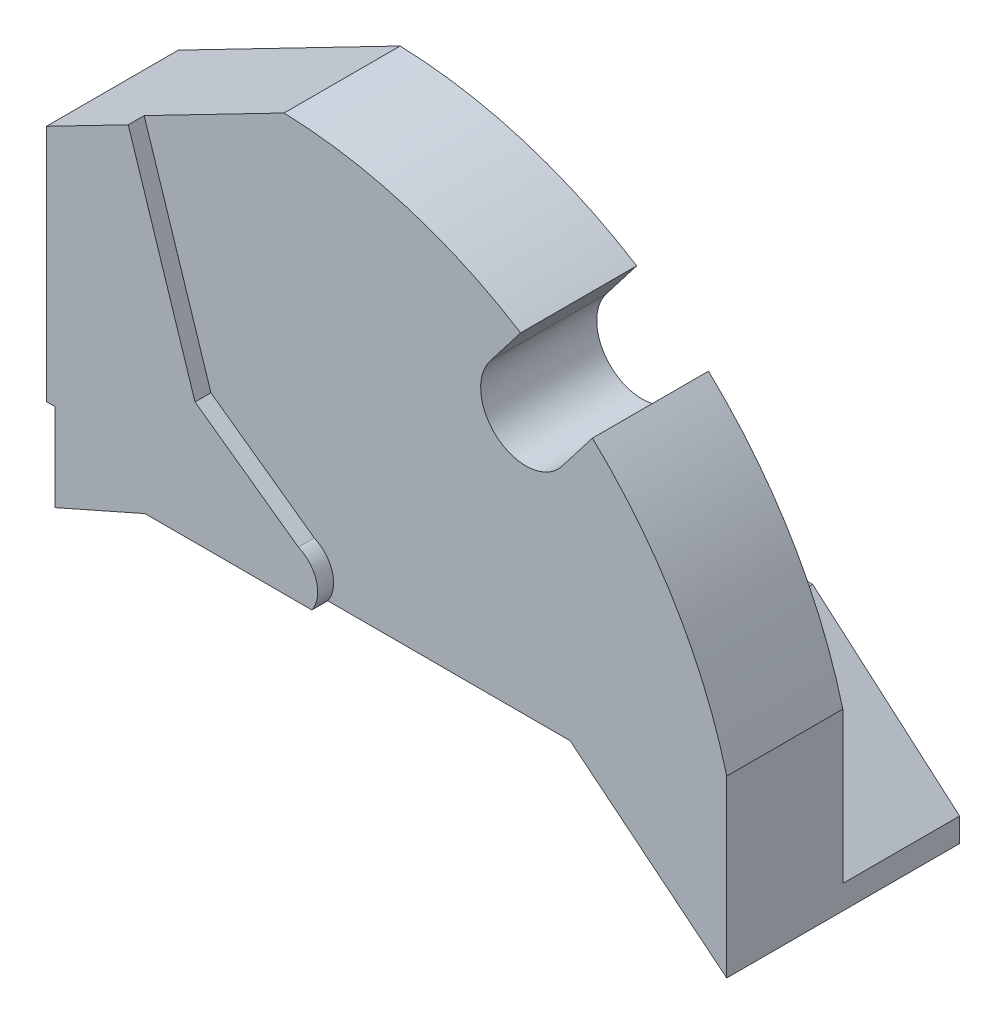
from build123d import *

# Parameters (mm, degrees)
ESTRUSIONE_ESTRUSIONE1_DEPTH  = 14.6
SCHIZZO2_W                    = 64
SCHIZZO2_H                    = 3
ESTRUSIONE_ESTRUSIONE2_DEPTH  = 14.7
ESTRUSIONE_ESTRUSIONE3_DEPTH  = 11.3
ESTRUSIONE_ESTRUSIONE4_DEPTH  = 14.9
SCHIZZO6_W                    = 64
SCHIZZO6_H                    = 3.1
ESTRUSIONE_ESTRUSIONE5_DEPTH  = 13
ESTRUSIONE_ESTRUSIONE8_START  = -64
ESTRUSIONE_ESTRUSIONE8_DEPTH  = 64
ESTRUSIONE_ESTRUSIONE9_DEPTH  = 14.6
ESTRUSIONE_ESTRUSIONE13_DEPTH = 14.7
ESTRUSIONE_ESTRUSIONE14_START = -3.1
ESTRUSIONE_ESTRUSIONE14_DEPTH = 3.1
TAGLIO_ESTRUSIONE3_DEPTH      = 15
TAGLIO_ESTRUSIONE4_REACH      = 94.756
ESTRUSIONE_ESTRUSIONE15_DEPTH = 2


with BuildPart() as part:
    # Schizzo1 → Estrusione-Estrusione1 (new body)
    with BuildSketch(Plane.XY):
        with BuildLine():
            Line((0, 30), (0, 0))
            Line((0, 0), (1.1, 0))
            Line((1.1, 0), (1.1, -6))
            Line((1.1, -6), (83.6, -6))
            Line((83.6, -6), (83.6, 0))
            ThreePointArc((83.6, 0), (77.157447993, 15.380640119), (66.7, 28.36957188))
            Line((66.7, 28.36957188), (62.855201518, 23.378827984))
            ThreePointArc((62.855201518, 23.378827984), (54.861139367, 22.342020228), (53.824331611, 30.336082379))
            Line((53.824331611, 30.336082379), (57.669130093, 35.326826275))
            ThreePointArc((57.669130093, 35.326826275), (43.389650216, 41.844502061), (27.902688632, 44.401387681))
            Line((27.902688632, 44.401387681), (0, 30))
        make_face()
    extrude(amount=ESTRUSIONE_ESTRUSIONE1_DEPTH)

    # Schizzo2 → Estrusione-Estrusione2 (add)
    with BuildSketch(Plane(origin=(0, 0, 0), x_dir=(-1, 0, 0), z_dir=(0, 0, -1))):
        with Locations((-33.1, -4.5)):
            Rectangle(SCHIZZO2_W, SCHIZZO2_H)
    extrude(amount=ESTRUSIONE_ESTRUSIONE2_DEPTH)

    # Schizzo4 → Estrusione-Estrusione3 (add)
    with BuildSketch(Plane.XY.offset(14.6)):
        Polygon((1.1, -6), (12.4, -6), (1.1, -11), align=None)
    extrude(amount=-ESTRUSIONE_ESTRUSIONE3_DEPTH)

    # Schizzo5 → Estrusione-Estrusione4 (add)
    with BuildSketch(Plane(origin=(0, 0, 3.3), x_dir=(-1, 0, 0), z_dir=(0, 0, -1))):
        Polygon((-1.1, -6), (-33.8, -6), (-1.1, -19), align=None)
    extrude(amount=ESTRUSIONE_ESTRUSIONE4_DEPTH)

    # Schizzo6 → Estrusione-Estrusione5 (add)
    with BuildSketch(Plane.XZ.offset(6)):
        with Locations((33.1, -13.15)):
            Rectangle(SCHIZZO6_W, SCHIZZO6_H)
    extrude(amount=ESTRUSIONE_ESTRUSIONE5_DEPTH)

    # Schizzo7 → Estrusione-Estrusione8 (add)
    with BuildSketch(Plane(origin=(65.1, 0, 0), x_dir=(0, 0, -1), z_dir=(1, 0, 0)).offset(ESTRUSIONE_ESTRUSIONE8_START)):
        Polygon((14.7, -19), (14.7, -22.05), (11.6, -19), align=None)
    extrude(amount=ESTRUSIONE_ESTRUSIONE8_DEPTH)

    # Schizzo9 → Estrusione-Estrusione9 (add)
    with BuildSketch(Plane.XY):
        Polygon((83.6, -6), (65.1, -6), (83.6, -22), align=None)
    extrude(amount=ESTRUSIONE_ESTRUSIONE9_DEPTH)

    # Schizzo16 → Estrusione-Estrusione13 (add)
    with BuildSketch(Plane(origin=(0, 0, 0), x_dir=(-1, 0, 0), z_dir=(0, 0, -1))):
        Polygon((-65.1, -3), (-83.6, -19), (-83.6, -22), (-65.1, -6), align=None)
    extrude(amount=ESTRUSIONE_ESTRUSIONE13_DEPTH)

    # Schizzo17 → Estrusione-Estrusione14 (add)
    with BuildSketch(Plane(origin=(0, 0, -14.7), x_dir=(-1, 0, 0), z_dir=(0, 0, -1)).offset(ESTRUSIONE_ESTRUSIONE14_START)):
        Polygon((-65.1, -6), (-65.1, -22.05), (-83.6, -22), align=None)
    extrude(amount=ESTRUSIONE_ESTRUSIONE14_DEPTH)

    # Schizzo18 → Taglio-Estrusione3 (cut)
    with BuildSketch(Plane.ZY.offset(-65.1)):
        Polygon((-11.6, -22.05), (-11.6, -19), (-14.7, -22.05), align=None)
    extrude(amount=-TAGLIO_ESTRUSIONE3_DEPTH, mode=Mode.SUBTRACT)

    # Taglio-Estrusione4: up to this face of the body (flat: up to its plane)
    taglio_estrusione4_end = Plane(part.part.faces().sort_by_distance((74.35, -14, 1.5))[0])
    # Schizzo20 → Taglio-Estrusione4 (cut, up to the picked face)
    with BuildSketch(Plane.ZY.offset(-80.1), mode=Mode.PRIVATE) as taglio_estrusione4_sk1:
        Polygon((-11.6, -22.009459459), (-11.6, -19), (-14.65879486, -22.009459459), align=None)
    taglio_estrusione4_tool1 = split(extrude(taglio_estrusione4_sk1.sketch, amount=-TAGLIO_ESTRUSIONE4_REACH, mode=Mode.PRIVATE), bisect_by=taglio_estrusione4_end, keep=Keep.BOTH, mode=Mode.PRIVATE)
    add(taglio_estrusione4_tool1.solids().sort_by(Axis((80.1, -21.006306, -12.619598), (1, 0, 0)))[0], mode=Mode.SUBTRACT)

    # Schizzo22 → Loft3 section 0
    with BuildSketch(Plane(origin=(0, 0, -14.7), x_dir=(-1, 0, 0), z_dir=(0, 0, -1))):
        with BuildLine():
            Line((-65.1, -6), (-62.68232007, -6))
            Line((-62.68232007, -6), (-83.6, -22))
            Line((-83.6, -22), (-65.1, -6))
        make_face()
    # Schizzo23 → Loft3 section 1
    with BuildSketch(Plane.XY.offset(14.6)):
        with BuildLine():
            Line((65.1, -6), (83.6, -22))
            Line((83.6, -22), (63.891160035, -6))
            Line((63.891160035, -6), (65.1, -6))
        make_face()
    loft()

    # Schizzo19 → Estrusione-Estrusione15 (add)
    with BuildSketch(Plane.XY.offset(14.6)):
        with BuildLine():
            Line((0, 30), (10.3, 35.316129032))
            Line((10.3, 35.316129032), (18.7, 9.316129032))
            Line((18.7, 9.316129032), (31.7, 0))
            ThreePointArc((31.7, 0), (33.987904201, -2.59259381), (33.4, -6))
            Line((33.4, -6), (12.4, -6))
            Line((12.4, -6), (1.1, -11))
            Line((1.1, -11), (1.1, 0))
            Line((1.1, 0), (0, 0))
            Line((0, 0), (0, 30))
        make_face()
    extrude(amount=ESTRUSIONE_ESTRUSIONE15_DEPTH)


solid = part.part
